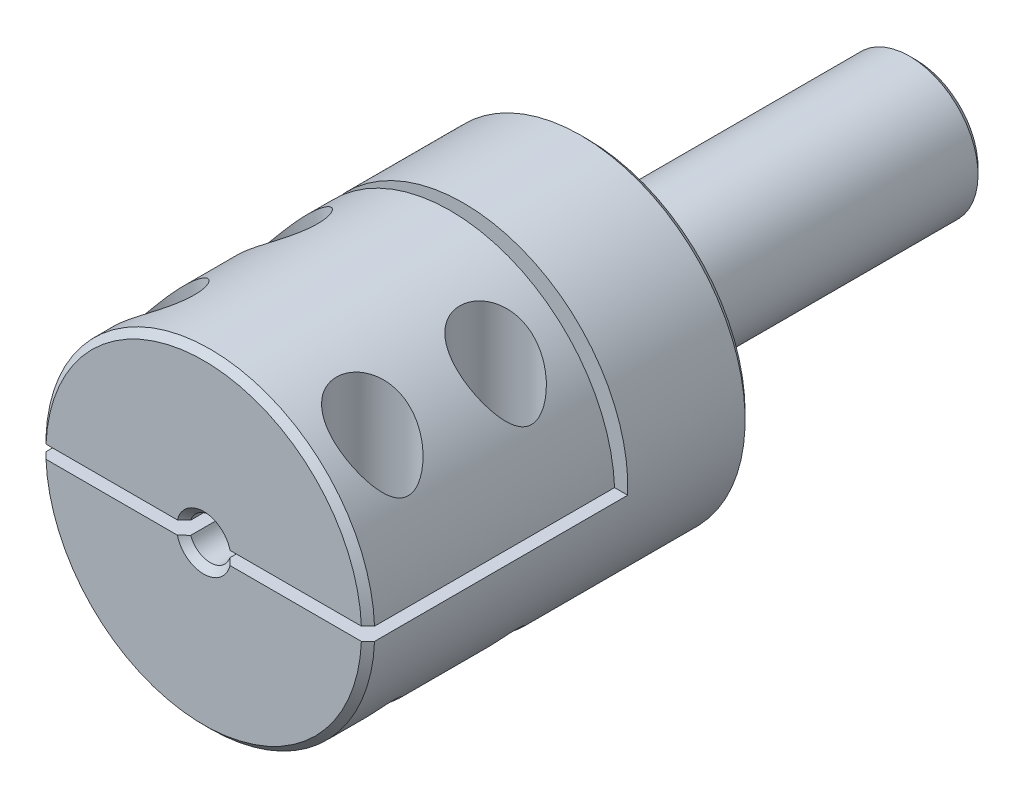
from build123d import *

# Parameters (mm, degrees)
SKETCH11_R              = 4.16052
CUT_EXTRUDE4_DEPTH      = 52.125133793
LPATTERN1_COUNT         = 2
LPATTERN1_PITCH         = 14.2875
LPATTERN1_COUNT_DIR2    = 2
LPATTERN1_PITCH_DIR2    = 24.7904
CHAMFER1_SIZE           = 0.762
FILLET1_R               = 0.762
CUT_EXTRUDE6_DEPTH      = 50.289254738
CUT_EXTRUDE6_DEPTH_BACK = 50.289254738


with BuildPart() as part:
    # Sketch1 → Revolve1 (revolve)
    with BuildSketch(Plane(origin=(0, 0, 0), x_dir=(0, 0, -1), z_dir=(1, 0, 0))):
        Polygon((-41.275, 19.05), (3.175, 19.05), (3.175, 7.9375), (41.275, 7.9375), (41.275, 0), (-4.919200651, 0), (-6.35, 2.38125), (-41.275, 2.38125), align=None)
    revolve(axis=Axis((0, 0, -41.275), (0, 0, 1)))

    # Sketch4 → Cut-Revolve1 (revolve, cut)
    with BuildSketch(Plane.XY.offset(34.13125), mode=Mode.PRIVATE) as cut_revolve1_sk:
        Polygon((14.8082, 4.3434), (16.3576, 4.3434), (16.3576, 9.1694), (16.3576, 19.05), (12.3952, 19.05), (12.3952, -19.05), (14.8082, -19.05), align=None)
    cut_revolve1 = revolve(cut_revolve1_sk.sketch.rotate(Axis((12.3952, -19.05, 34.13125), (0, 1, 0)), 90), axis=Axis((12.3952, -19.05, 34.13125), (0, 1, 0)), mode=Mode.SUBTRACT)

    # Sketch11 → Cut-Extrude4 (cut, through all)
    with BuildSketch(Plane(origin=(0, 4.3434, 0), x_dir=(1, 0, 0), z_dir=(0, 1, 0))):
        with Locations(Location((12.3952, -34.13125, 0), (0, 0, 90))):
            Circle(SKETCH11_R)
    cut_extrude4 = extrude(amount=CUT_EXTRUDE4_DEPTH, mode=Mode.SUBTRACT)

    # LPattern1: Cut-Revolve1, Cut-Extrude4 2 × 2
    with Locations(*[(-j * LPATTERN1_PITCH_DIR2, 0, -i * LPATTERN1_PITCH) for i in range(LPATTERN1_COUNT) for j in range(LPATTERN1_COUNT_DIR2) if (i, j) != (0, 0)]):
        add(cut_revolve1, mode=Mode.SUBTRACT)
        add(cut_extrude4, mode=Mode.SUBTRACT)

    # Chamfer1
    chamfer1_edges = [part.edges().sort_by_distance(p)[0] for p in [
        (0, -2.38125, 41.275),
        (0, -7.9375, -41.275),
        (0, -19.05, -3.175),
        (0, -19.05, 41.275),
    ]]
    chamfer(chamfer1_edges, length=CHAMFER1_SIZE)

    # Fillet1
    fillet1_edges = [part.edges().sort_by_distance(p)[0] for p in [
        (0, -7.9375, -3.175),
    ]]
    fillet(fillet1_edges, radius=FILLET1_R)

    # Sketch14 → Cut-Extrude6 (cut, two sides: drawn at the far end of the back side and taken through both)
    with BuildSketch(Plane(origin=(0, 0, 0), x_dir=(0, 0, -1), z_dir=(1, 0, 0)).offset(-CUT_EXTRUDE6_DEPTH_BACK)):
        Polygon((-41.275, 0.762), (-12.7, 0.762), (-12.7, 19.05), (-11.176, 19.05), (-11.176, -0.762), (-41.275, -0.762), align=None)
    extrude(amount=CUT_EXTRUDE6_DEPTH + CUT_EXTRUDE6_DEPTH_BACK, mode=Mode.SUBTRACT)


with BuildPart() as cut_extrude6_piece_1:
    # of the separate pieces the step leaves, piece 1, a body of its own (cut_extrude6_pieces)
    add(part.part.solids().sort_by_distance((0, 8.6995, -3.175))[0])


with BuildPart() as cut_extrude6_piece_2:
    # of the separate pieces the step leaves, piece 2, a body of its own (cut_extrude6_pieces)
    add(part.part.solids().sort_by_distance((19.034753899, 0.762, 40.513))[0])


solid = Compound([cut_extrude6_piece_1.part, cut_extrude6_piece_2.part])
